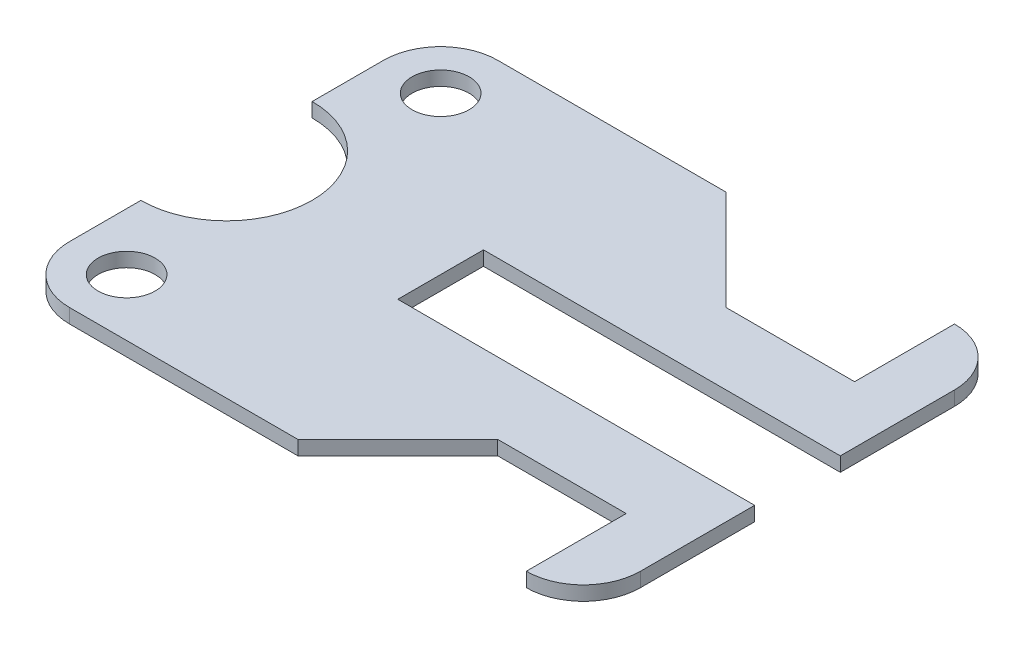
from build123d import *

# Parameters (mm, degrees)
SKETCH1_R           = 2
BOSS_EXTRUDE1_DEPTH = 1


with BuildPart() as part:
    # Sketch1 → Boss-Extrude1 (new body)
    with BuildSketch(Plane(origin=(0, 0, 0), x_dir=(1, 0, 0), z_dir=(0, 1, 0))):
        with BuildLine():
            Line((-20, 6), (-20, 11))
            ThreePointArc((-20, 11), (-18.828427125, 13.828427125), (-16, 15))
            Line((-16, 15), (0, 15))
            Line((0, 15), (7, 8))
            Line((7, 8), (16, 8))
            Line((16, 8), (16, 15))
            ThreePointArc((16, 15), (18.828427125, 13.828427125), (20, 11))
            Line((20, 11), (20, 3))
            Line((20, 3), (-5, 3))
            Line((-5, 3), (-5, -3))
            Line((-5, -3), (20, -3))
            Line((20, -3), (20, -11))
            ThreePointArc((20, -11), (18.828427125, -13.828427125), (16, -15))
            Line((16, -15), (16, -8))
            Line((16, -8), (7, -8))
            Line((7, -8), (0, -15))
            Line((0, -15), (-16, -15))
            ThreePointArc((-16, -15), (-18.828427125, -13.828427125), (-20, -11))
            Line((-20, -11), (-20, -6))
            ThreePointArc((-20, -6), (-14, 0), (-20, 6))
        make_face()
        with Locations(Location((-16, -11, 0), (0, 0, 270))):
            Circle(SKETCH1_R, mode=Mode.SUBTRACT)
        with Locations(Location((-16, 11, 0), (0, 0, 270))):
            Circle(SKETCH1_R, mode=Mode.SUBTRACT)
    extrude(amount=BOSS_EXTRUDE1_DEPTH)


solid = part.part
